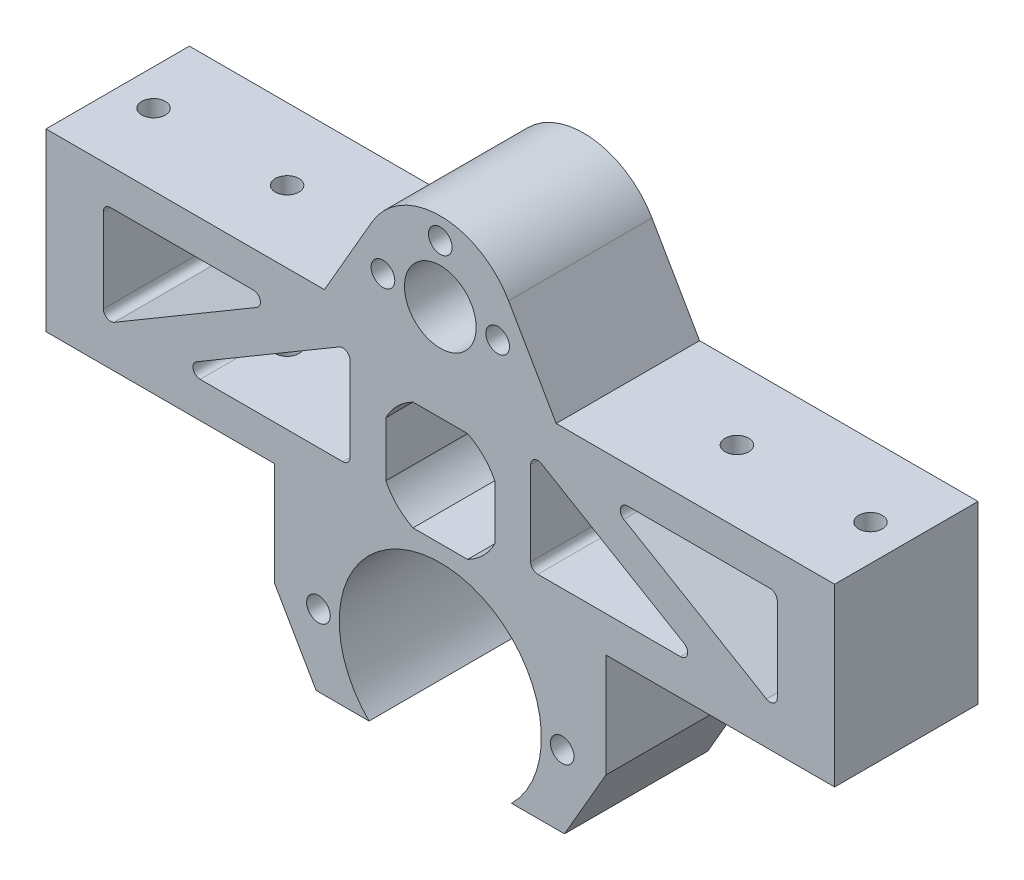
from build123d import *

# Parameters (mm, degrees)
SKETCH_1_R          = 5
SKETCH_1_R_2        = 1.65
EXTRUDE_1_DEPTH     = 20
SKETCH_2_R          = 1.65
CUT_EXTRUDE_1_DEPTH = 71.32780389
EXTRUDE_START       = -20
EXTRUDE_2_DEPTH     = 20
SKETCH_4_R          = 1.65
CUT_EXTRUDE_2_DEPTH = 82
EXTRUDE_5_DEPTH     = 20
CUT_EXTRUDE_3_DEPTH = 20
SKETCH_8_W          = 31.905989232
SKETCH_8_H          = 14.5
CUT_EXTRUDE_5_DEPTH = 82
CUT_EXTRUDE_6_DEPTH = 82
FILLET_3_R          = 1


with BuildPart() as part:
    # 草图1 → 凸台-拉伸1 (new body)
    with BuildSketch(Plane.XY):
        with BuildLine():
            Line((55, 39), (16.165807537, 39))
            Line((16.165807537, 39), (9.526279442, 50.5))
            ThreePointArc((9.526279442, 50.5), (0, 56), (-9.526279442, 50.5))
            Line((-9.526279442, 50.5), (-16.165807537, 39))
            Line((-16.165807537, 39), (-55, 39))
            Line((-55, 39), (-55, 0))
            Line((-55, 0), (-14.1, 0))
            ThreePointArc((-14.1, 0), (0, 14.1), (14.1, 0))
            Line((14.1, 0), (55, 0))
            Line((55, 0), (55, 39))
        make_face()
        with Locations((0, 45)):
            Circle(SKETCH_1_R, mode=Mode.SUBTRACT)
        with Locations((-8, 45)):
            Circle(SKETCH_1_R_2, mode=Mode.SUBTRACT)
        with Locations((8, 45)):
            Circle(SKETCH_1_R_2, mode=Mode.SUBTRACT)
        with Locations((0, 53)):
            Circle(SKETCH_1_R_2, mode=Mode.SUBTRACT)
    extrude(amount=EXTRUDE_1_DEPTH)

    # 草图2 → 切除-拉伸1 (cut, through all)
    with BuildSketch(Plane(origin=(0, 39, 0), x_dir=(1, 0, 0), z_dir=(0, 1, 0))):
        with Locations((-50, -10)):
            Circle(SKETCH_2_R)
        with Locations((-31.37, -10)):
            Circle(SKETCH_2_R)
        with Locations((31.37, -10)):
            Circle(SKETCH_2_R)
        with Locations((50, -10)):
            Circle(SKETCH_2_R)
    extrude(amount=-CUT_EXTRUDE_1_DEPTH, mode=Mode.SUBTRACT)

    # 草图3 → 凸台-拉伸2 (add)
    with BuildSketch(Plane.XY.offset(20).offset(EXTRUDE_START)):
        with BuildLine():
            ThreePointArc((-20, 0), (-19.318516526, -5.176380902), (-17.320508076, -10))
            Line((-17.320508076, -10), (-9.940321926, -10))
            ThreePointArc((-9.940321926, -10), (-13.018612429, -5.415323667), (-14.1, 0))
            Line((-14.1, 0), (-20, 0))
        make_face()
        with BuildLine():
            Line((9.940321926, -10), (17.320508076, -10))
            ThreePointArc((17.320508076, -10), (19.318516526, -5.176380902), (20, 0))
            Line((20, 0), (14.1, 0))
            ThreePointArc((14.1, 0), (13.018612429, -5.415323667), (9.940321926, -10))
        make_face()
    extrude(amount=EXTRUDE_2_DEPTH)

    # 草图4 → 切除-拉伸2 (cut, through all)
    with BuildSketch(Plane.XY.offset(20)):
        with Locations((17, 0)):
            Circle(SKETCH_4_R)
        with Locations((-17, 0)):
            Circle(SKETCH_4_R)
    extrude(amount=-CUT_EXTRUDE_2_DEPTH, mode=Mode.SUBTRACT)

    # 草图5 → 凸台-拉伸5 (add)
    with BuildSketch(Plane.XY.offset(20).offset(EXTRUDE_START)):
        with BuildLine():
            Line((-17.320508076, -10), (-23.094010768, 0))
            Line((-23.094010768, 0), (-20, 0))
            ThreePointArc((-20, 0), (-19.318516526, -5.176380902), (-17.320508076, -10))
        make_face()
        with BuildLine():
            Line((17.320508076, -10), (23.094010768, 0))
            Line((23.094010768, 0), (20, 0))
            ThreePointArc((20, 0), (19.318516526, -5.176380902), (17.320508076, -10))
        make_face()
    extrude(amount=EXTRUDE_5_DEPTH)

    # 草图6 → 切除-拉伸3 (cut)
    with BuildSketch(Plane.XY.offset(20)):
        with BuildLine():
            Line((3.806573262, 31.6), (-3.806573262, 31.6))
            ThreePointArc((-3.806573262, 31.6), (-6.01040764, 30.01040764), (-7.6, 27.806573262))
            Line((-7.6, 27.806573262), (-7.6, 20.193426738))
            ThreePointArc((-7.6, 20.193426738), (-6.01040764, 17.98959236), (-3.806573262, 16.4))
            Line((-3.806573262, 16.4), (3.806573262, 16.4))
            ThreePointArc((3.806573262, 16.4), (6.01040764, 17.98959236), (7.6, 20.193426738))
            Line((7.6, 20.193426738), (7.6, 27.806573262))
            ThreePointArc((7.6, 27.806573262), (6.01040764, 30.01040764), (3.806573262, 31.6))
        make_face()
    extrude(amount=-CUT_EXTRUDE_3_DEPTH, mode=Mode.SUBTRACT)

    # 草图8 → 切除-拉伸5 (cut, through all)
    with BuildSketch(Plane(origin=(0, 0, 0), x_dir=(-1, 0, 0), z_dir=(0, 0, -1))):
        with Locations((-39.047005384, 7.25)):
            Rectangle(SKETCH_8_W, SKETCH_8_H)
        with Locations((39.047005384, 7.25)):
            Rectangle(SKETCH_8_W, SKETCH_8_H)
    extrude(amount=-CUT_EXTRUDE_5_DEPTH, mode=Mode.SUBTRACT)

    # 草图9 → 切除-拉伸6 (cut, through all)
    with BuildSketch(Plane(origin=(0, 0, 0), x_dir=(-1, 0, 0), z_dir=(0, 0, -1))):
        Polygon((-47, 34), (-47, 19.5), (-22.435993944, 34), align=None)
        Polygon((-37.164006056, 19.5), (-12.6, 34), (-12.6, 19.5), align=None)
        Polygon((12.6, 19.5), (37.164006056, 19.5), (12.6, 34), align=None)
        Polygon((22.435993944, 34), (47, 34), (47, 19.5), align=None)
    extrude(amount=-CUT_EXTRUDE_6_DEPTH, mode=Mode.SUBTRACT)

    # 圆角3
    fillet_3_edges = [part.edges().sort_by_distance(p)[0] for p in [
        (-47, 19.5, 10),
        (-47, 34, 10),
        (-22.435993944, 34, 10),
        (-37.164006056, 19.5, 10),
        (-12.6, 34, 10),
        (-12.6, 19.5, 10),
        (12.6, 34, 10),
        (12.6, 19.5, 10),
        (22.435993944, 34, 10),
        (47, 34, 10),
        (47, 19.5, 10),
        (37.164006056, 19.5, 10),
    ]]
    fillet(fillet_3_edges, radius=FILLET_3_R)


solid = part.part
